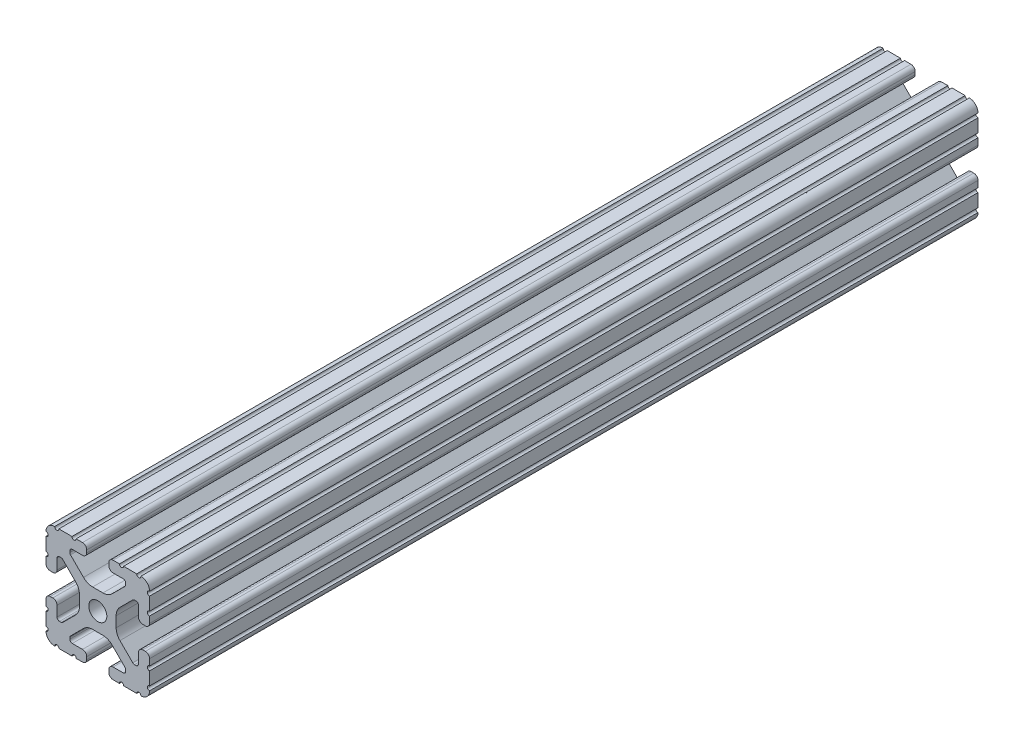
from build123d import *

# Parameters (mm, degrees)
SKETCH1_R = 3.3274


with BuildPart() as part:
    # Sweep4: sweep along a path in Sketch2
    with BuildLine(Plane(origin=(0, 0, 0), x_dir=(1, 0, 0), z_dir=(0, 1, 0))) as sweep4_path:
        Line((0, 0), (0, 304.8))
    # Sketch1 → Sweep4 (sweep)
    with BuildSketch(Plane(origin=(0, 0, -304.8), x_dir=(-1, 0, 0), z_dir=(0, 0, -1))):
        with BuildLine():
            Line((14.327719201, 19.050000003), (9.498178698, 19.050000003))
            ThreePointArc((9.498178698, 19.050000003), (8.736178698, 18.288000003), (7.974178698, 19.050000003))
            Line((7.974178698, 19.050000003), (5.61761756, 19.050000003))
            ThreePointArc((5.61761756, 19.050000003), (4.519044055, 18.594955959), (4.06400001, 17.496382454))
            Line((4.06400001, 17.496382454), (4.06400001, 16.539617563))
            ThreePointArc((4.06400001, 16.539617563), (4.519044055, 15.441044058), (5.61761756, 14.986000013))
            Line((5.61761756, 14.986000013), (9.38530001, 14.986000013))
            ThreePointArc((9.38530001, 14.986000013), (10.022898195, 14.721898198), (10.28700001, 14.084300013))
            Line((10.28700001, 14.084300013), (10.28700001, 13.552357144))
            ThreePointArc((10.28700001, 13.552357144), (10.218362397, 13.207292006), (10.022898979, 12.914759744))
            Line((10.022898979, 12.914759744), (5.252158118, 8.144007146))
            ThreePointArc((5.252158118, 8.144007146), (3.715177385, 7.117027402), (1.902183988, 6.756400013))
            Line((1.902183988, 6.756400013), (-1.902183965, 6.756400013))
            ThreePointArc((-1.902183965, 6.756400013), (-3.715177361, 7.117027401), (-5.252158094, 8.144007145))
            Line((-5.252158094, 8.144007145), (-10.022898959, 12.914759744))
            ThreePointArc((-10.022898959, 12.914759744), (-10.218362376, 13.207292006), (-10.28699999, 13.552357144))
            Line((-10.28699999, 13.552357144), (-10.28699999, 14.084300013))
            ThreePointArc((-10.28699999, 14.084300013), (-10.022898174, 14.721898198), (-9.38529999, 14.986000013))
            Line((-9.38529999, 14.986000013), (-5.617617539, 14.986000013))
            ThreePointArc((-5.617617539, 14.986000013), (-4.519044035, 15.441044058), (-4.06399999, 16.539617563))
            Line((-4.06399999, 16.539617563), (-4.06399999, 17.496382454))
            ThreePointArc((-4.06399999, 17.496382454), (-4.519044035, 18.594955959), (-5.617617539, 19.050000003))
            Line((-5.617617539, 19.050000003), (-7.974178709, 19.050000003))
            ThreePointArc((-7.974178709, 19.050000003), (-8.736178709, 18.288000003), (-9.498178709, 19.050000003))
            Line((-9.498178709, 19.050000003), (-14.327719212, 19.050000003))
            ThreePointArc((-14.327719212, 19.050000003), (-15.087603125, 18.231251135), (-15.847487045, 19.049999996))
            ThreePointArc((-15.847487045, 19.049999996), (-18.120176306, 18.120192065), (-19.050000001, 15.847509253))
            ThreePointArc((-19.050000001, 15.847509253), (-18.231251012, 15.087625373), (-19.049999993, 14.327741484))
            Line((-19.049999993, 14.327741484), (-19.049999993, 9.49609147))
            ThreePointArc((-19.049999993, 9.49609147), (-18.231250986, 8.736207564), (-19.049999993, 7.976323658))
            Line((-19.049999993, 7.976323658), (-19.049999993, 5.617617549))
            ThreePointArc((-19.049999993, 5.617617549), (-18.594955948, 4.519044045), (-17.496382444, 4.064))
            Line((-17.496382444, 4.064), (-16.539617542, 4.064))
            ThreePointArc((-16.539617542, 4.064), (-15.441044038, 4.519044045), (-14.985999993, 5.617617549))
            Line((-14.985999993, 5.617617549), (-14.985999993, 9.385342517))
            ThreePointArc((-14.985999993, 9.385342517), (-14.721898178, 10.022940702), (-14.084299993, 10.287042517))
            Line((-14.084299993, 10.287042517), (-13.516042079, 10.287042517))
            ThreePointArc((-13.516042079, 10.287042517), (-13.170975915, 10.218404479), (-12.87844311, 10.022939917))
            Line((-12.87844311, 10.022939917), (-8.147580073, 5.292065242))
            ThreePointArc((-8.147580073, 5.292065242), (-7.117955872, 3.751120652), (-6.756399993, 1.933453584))
            Line((-6.756399993, 1.933453584), (-6.756399993, -1.933453584))
            ThreePointArc((-6.756399993, -1.933453584), (-7.117955872, -3.751120652), (-8.147580073, -5.292065242))
            Line((-8.147580073, -5.292065242), (-12.87844311, -10.022939917))
            ThreePointArc((-12.87844311, -10.022939917), (-13.170975915, -10.218404479), (-13.516042079, -10.287042517))
            Line((-13.516042079, -10.287042517), (-14.084299993, -10.287042517))
            ThreePointArc((-14.084299993, -10.287042517), (-14.721898178, -10.022940702), (-14.985999993, -9.385342517))
            Line((-14.985999993, -9.385342517), (-14.985999993, -5.617617549))
            ThreePointArc((-14.985999993, -5.617617549), (-15.441044038, -4.519044045), (-16.539617542, -4.064))
            Line((-16.539617542, -4.064), (-17.496382444, -4.064))
            ThreePointArc((-17.496382444, -4.064), (-18.594955948, -4.519044045), (-19.049999993, -5.617617549))
            Line((-19.049999993, -5.617617549), (-19.049999993, -7.97631849))
            ThreePointArc((-19.049999993, -7.97631849), (-18.231250986, -8.736202396), (-19.049999993, -9.496086301))
            Line((-19.049999993, -9.496086301), (-19.049999993, -14.327742909))
            ThreePointArc((-19.049999993, -14.327742909), (-18.231250983, -15.08762681), (-19.049999984, -15.847510721))
            ThreePointArc((-19.049999984, -15.847510721), (-18.120175688, -18.120192657), (-15.847486815, -19.049999997))
            ThreePointArc((-15.847486815, -19.049999997), (-15.087602925, -18.231251148), (-14.327719025, -19.049999987))
            Line((-14.327719025, -19.049999987), (-9.496062438, -19.049999987))
            ThreePointArc((-9.496062438, -19.049999987), (-8.736178522, -18.231251122), (-7.976294605, -19.049999987))
            Line((-7.976294605, -19.049999987), (-5.617617539, -19.049999987))
            ThreePointArc((-5.617617539, -19.049999987), (-4.519044035, -18.594955942), (-4.06399999, -17.496382437))
            Line((-4.06399999, -17.496382437), (-4.06399999, -16.539617536))
            ThreePointArc((-4.06399999, -16.539617536), (-4.519044035, -15.441044031), (-5.617617539, -14.985999987))
            Line((-5.617617539, -14.985999987), (-9.38529999, -14.985999987))
            ThreePointArc((-9.38529999, -14.985999987), (-10.022898174, -14.721898171), (-10.28699999, -14.084299987))
            Line((-10.28699999, -14.084299987), (-10.28699999, -13.552357118))
            ThreePointArc((-10.28699999, -13.552357118), (-10.218362376, -13.207291979), (-10.022898959, -12.914759717))
            Line((-10.022898959, -12.914759717), (-5.252158094, -8.144007118))
            ThreePointArc((-5.252158094, -8.144007118), (-3.715177361, -7.117027375), (-1.902183965, -6.756399987))
            Line((-1.902183965, -6.756399987), (1.902183988, -6.756399987))
            ThreePointArc((1.902183988, -6.756399987), (3.715177385, -7.117027375), (5.252158118, -8.144007119))
            Line((5.252158118, -8.144007119), (10.022898979, -12.914759717))
            ThreePointArc((10.022898979, -12.914759717), (10.218362397, -13.207291979), (10.28700001, -13.552357118))
            Line((10.28700001, -13.552357118), (10.28700001, -14.084299987))
            ThreePointArc((10.28700001, -14.084299987), (10.022898195, -14.721898171), (9.38530001, -14.985999987))
            Line((9.38530001, -14.985999987), (5.61761756, -14.985999987))
            ThreePointArc((5.61761756, -14.985999987), (4.519044055, -15.441044031), (4.06400001, -16.539617536))
            Line((4.06400001, -16.539617536), (4.06400001, -17.496382437))
            ThreePointArc((4.06400001, -17.496382437), (4.519044055, -18.594955942), (5.61761756, -19.049999987))
            Line((5.61761756, -19.049999987), (7.976294626, -19.049999987))
            ThreePointArc((7.976294626, -19.049999987), (8.736178543, -18.231251122), (9.496062459, -19.049999987))
            Line((9.496062459, -19.049999987), (14.327719046, -19.049999987))
            ThreePointArc((14.327719046, -19.049999987), (15.087602959, -18.231251119), (15.847486878, -19.04999998))
            ThreePointArc((15.847486878, -19.04999998), (18.12017574, -18.120192611), (19.050000007, -15.847510662))
            ThreePointArc((19.050000007, -15.847510662), (18.231250911, -15.087626785), (19.050000007, -14.327742909))
            Line((19.050000007, -14.327742909), (19.050000007, -9.496086301))
            ThreePointArc((19.050000007, -9.496086301), (18.231251003, -8.736202395), (19.050000007, -7.976318489))
            Line((19.050000007, -7.976318489), (19.050000007, -5.617617549))
            ThreePointArc((19.050000007, -5.617617549), (18.594955962, -4.519044045), (17.496382458, -4.064))
            Line((17.496382458, -4.064), (16.539617556, -4.064))
            ThreePointArc((16.539617556, -4.064), (15.441044052, -4.519044045), (14.986000007, -5.617617549))
            Line((14.986000007, -5.617617549), (14.986000007, -9.385342517))
            ThreePointArc((14.986000007, -9.385342517), (14.721898191, -10.022940702), (14.084300007, -10.287042517))
            Line((14.084300007, -10.287042517), (13.516042095, -10.287042517))
            ThreePointArc((13.516042095, -10.287042517), (13.170975932, -10.218404479), (12.878443126, -10.022939918))
            Line((12.878443126, -10.022939918), (8.147580087, -5.292065243))
            ThreePointArc((8.147580087, -5.292065243), (7.117955886, -3.751120653), (6.756400007, -1.933453584))
            Line((6.756400007, -1.933453584), (6.756400007, 1.933453584))
            ThreePointArc((6.756400007, 1.933453584), (7.117955886, 3.751120653), (8.147580087, 5.292065243))
            Line((8.147580087, 5.292065243), (12.878443126, 10.022939918))
            ThreePointArc((12.878443126, 10.022939918), (13.170975932, 10.218404479), (13.516042095, 10.287042517))
            Line((13.516042095, 10.287042517), (14.084300007, 10.287042517))
            ThreePointArc((14.084300007, 10.287042517), (14.721898191, 10.022940702), (14.986000007, 9.385342517))
            Line((14.986000007, 9.385342517), (14.986000007, 5.617617549))
            ThreePointArc((14.986000007, 5.617617549), (15.441044052, 4.519044045), (16.539617556, 4.064))
            Line((16.539617556, 4.064), (17.496382458, 4.064))
            ThreePointArc((17.496382458, 4.064), (18.594955962, 4.519044045), (19.050000007, 5.617617549))
            Line((19.050000007, 5.617617549), (19.050000007, 7.976323659))
            ThreePointArc((19.050000007, 7.976323659), (18.231251003, 8.736207565), (19.050000007, 9.496091471))
            Line((19.050000007, 9.496091471), (19.050000007, 14.327741484))
            ThreePointArc((19.050000007, 14.327741484), (18.231251061, 15.087625385), (19.049999988, 15.847509306))
            ThreePointArc((19.049999988, 15.847509306), (18.120176278, 18.120192088), (15.847487034, 19.050000003))
            ThreePointArc((15.847487034, 19.050000003), (15.087603117, 18.231251142), (14.327719201, 19.050000003))
        make_face()
        Circle(SKETCH1_R, mode=Mode.SUBTRACT)
    sweep(path=sweep4_path.line)


solid = part.part
